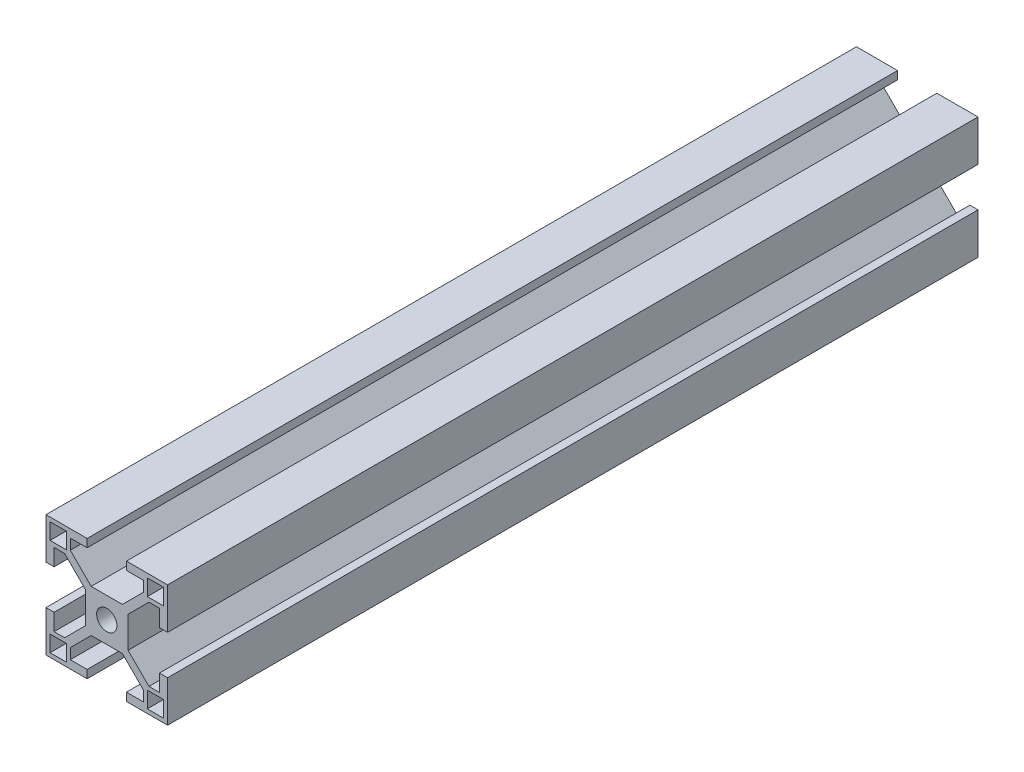
from build123d import *

# Parameters (mm, degrees)
SKETCH2_R           = 2.5
SKETCH2_W           = 4
SKETCH2_H           = 4
BOSS_EXTRUDE1_DEPTH = 200


with BuildPart() as part:
    # Sketch2 → Boss-Extrude1 (new body)
    with BuildSketch(Plane.XY):
        Polygon((-10.400071427, 9), (-5.25, 3.849928573), (-5.25, 0), (-5.25, -3.849928573), (-10.400071427, -9), (-13, -9), (-13, -4.85), (-15, -4.85), (-15, -9), (-15, -15), (-9, -15), (-4.85, -15), (-4.85, -13), (-9, -13), (-9, -10.400071427), (-3.849928573, -5.25), (0, -5.25), (3.849928573, -5.25), (9, -10.400071427), (9, -13), (4.85, -13), (4.85, -15), (9, -15), (15, -15), (15, -9), (15, -4.85), (13, -4.85), (13, -9), (10.400071427, -9), (5.25, -3.849928573), (5.25, 0), (5.25, 3.849928573), (10.400071427, 9), (13, 9), (13, 4.85), (15, 4.85), (15, 9), (15, 15), (9, 15), (4.85, 15), (4.85, 13), (9, 13), (9, 10.400071427), (3.849928573, 5.25), (0, 5.25), (-3.849928573, 5.25), (-9, 10.400071427), (-9, 13), (-4.85, 13), (-4.85, 15), (-9, 15), (-15, 15), (-15, 9), (-15, 4.85), (-13, 4.85), (-13, 9), align=None)
        Circle(SKETCH2_R, mode=Mode.SUBTRACT)
        with Locations((-12, 12)):
            Rectangle(SKETCH2_W, SKETCH2_H, mode=Mode.SUBTRACT)
        with Locations((12, 12)):
            Rectangle(SKETCH2_W, SKETCH2_H, mode=Mode.SUBTRACT)
        with Locations((12, -12)):
            Rectangle(SKETCH2_W, SKETCH2_H, mode=Mode.SUBTRACT)
        with Locations((-12, -12)):
            Rectangle(SKETCH2_W, SKETCH2_H, mode=Mode.SUBTRACT)
    extrude(amount=BOSS_EXTRUDE1_DEPTH)


solid = part.part
